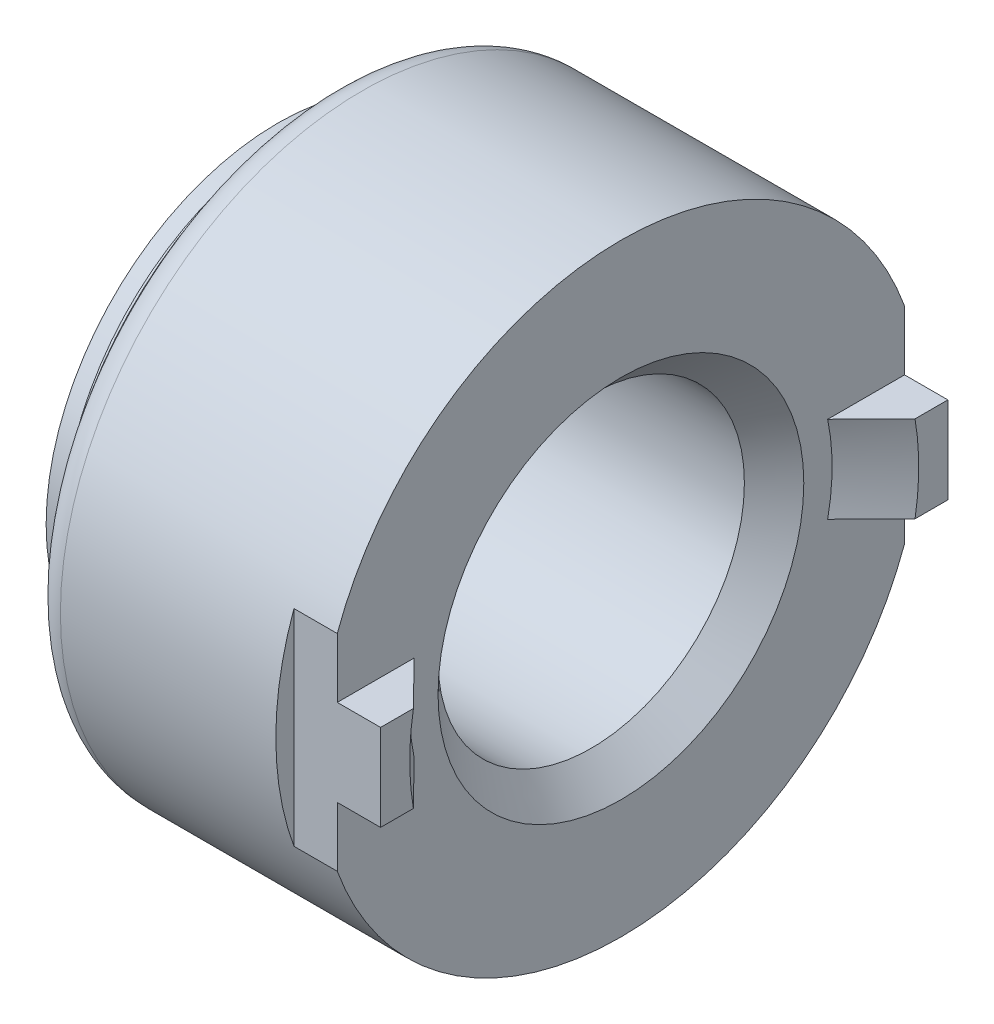
from build123d import *

# Parameters (mm, degrees)
ESQUISSE1_W             = 7.9
ESQUISSE1_H             = 8.25
BOSS_EXTRU_1_DEPTH      = 1.184
ENL_V_MAT_EXTRU_1_REACH = 15.462
BOSS_EXTRU_2_DEPTH      = 1.184
ENL_V_MAT_EXTRU_2_REACH = 15.462
ESQUISSE8_R             = 7.2925
BOSS_EXTRU_3_DEPTH      = 0.296
ESQUISSE9_R             = 6.10875
BOSS_EXTRU_4_DEPTH      = 0.74
BOSS_EXTRU_4_DRAFT      = -17.000658211
ESQUISSE10_R            = 6.335
BOSS_EXTRU_5_DEPTH      = 0.444
D_POUILLE1_ANGLE        = 44.999999999
PER_AGE1_D              = 8.376
CHANFREIN1_SIZE         = 0.812
CONG_1_R                = 0.825


with BuildPart() as part:
    # Esquisse1 → Révolution1 (revolve)
    with BuildSketch(Plane.XY, mode=Mode.PRIVATE) as r_volution1_sk:
        with Locations((5.43, 4.125)):
            Rectangle(ESQUISSE1_W, ESQUISSE1_H)
    revolve(r_volution1_sk.sketch.rotate(Axis((1.48, 0, 0), (1, 0, 0)), 270), axis=Axis((1.48, 0, 0), (1, 0, 0)))

    # Esquisse2 → Boss.-Extru.1 (add)
    with BuildSketch(Plane(origin=(9.38, 0, 0), x_dir=(0, 0, -1), z_dir=(1, 0, 0))):
        with BuildLine():
            Line((-5.652324212, -1.184), (-7.755, -1.184))
            Line((-7.755, -1.184), (-7.755, 1.184))
            Line((-7.755, 1.184), (-5.652324212, 1.184))
            ThreePointArc((-5.652324212, 1.184), (-5.775, 0), (-5.652324212, -1.184))
        make_face()
    extrude(amount=BOSS_EXTRU_1_DEPTH)

    # Esquisse4 → Enlèv. mat.-Extru.1 (cut, up to next)
    with BuildSketch(Plane(origin=(8.195, 0, 0), x_dir=(0, -1, 0), z_dir=(-1, 0, 0)), mode=Mode.PRIVATE) as enl_v_mat_extru_1_sk1:
        with BuildLine():
            Line((-2.814689148, 7.755), (2.814689148, 7.755))
            ThreePointArc((2.814689148, 7.755), (0, 8.25), (-2.814689148, 7.755))
        make_face()
    enl_v_mat_extru_1_tool1 = extrude(enl_v_mat_extru_1_sk1.sketch, amount=-ENL_V_MAT_EXTRU_1_REACH, mode=Mode.PRIVATE) & part.part
    add(enl_v_mat_extru_1_tool1.solids().sort_by_distance((8.195, 0, 7.953518))[0], mode=Mode.SUBTRACT)

    # Esquisse5 → Boss.-Extru.2 (add)
    with BuildSketch(Plane(origin=(9.38, 0, 0), x_dir=(0, 0, -1), z_dir=(1, 0, 0))):
        with BuildLine():
            Line((7.755, 1.184), (7.755, -1.184))
            Line((7.755, -1.184), (5.652324212, -1.184))
            ThreePointArc((5.652324212, -1.184), (5.775, 0), (5.652324212, 1.184))
            Line((5.652324212, 1.184), (7.755, 1.184))
        make_face()
    extrude(amount=BOSS_EXTRU_2_DEPTH)

    # Esquisse7 → Enlèv. mat.-Extru.2 (cut, up to next)
    with BuildSketch(Plane(origin=(8.195, 0, 0), x_dir=(0, -1, 0), z_dir=(-1, 0, 0)), mode=Mode.PRIVATE) as enl_v_mat_extru_2_sk1:
        with BuildLine():
            Line((2.814689148, -7.755), (-2.814689148, -7.755))
            ThreePointArc((-2.814689148, -7.755), (0, -8.25), (2.814689148, -7.755))
        make_face()
    enl_v_mat_extru_2_tool1 = extrude(enl_v_mat_extru_2_sk1.sketch, amount=-ENL_V_MAT_EXTRU_2_REACH, mode=Mode.PRIVATE) & part.part
    add(enl_v_mat_extru_2_tool1.solids().sort_by_distance((8.195, 0, -7.953518))[0], mode=Mode.SUBTRACT)

    # Esquisse8 → Boss.-Extru.3 (add)
    with BuildSketch(Plane.ZY.offset(-1.48)):
        with Locations(Location((0, 0, 0), (0, 0, 180))):
            Circle(ESQUISSE8_R)
    extrude(amount=BOSS_EXTRU_3_DEPTH)


with BuildPart() as boss_extru_4_tool:
    # Esquisse9 → Boss.-Extru.4 (with draft: the straight prism first)
    with BuildSketch(Plane.ZY.offset(-1.184)):
        Circle(ESQUISSE9_R)
    extrude(amount=BOSS_EXTRU_4_DEPTH)
    # Boss.-Extru.4: the draft: its side faces are tilted about the plane it starts from
    boss_extru_4_sides = [boss_extru_4_tool.faces().sort_by_distance(p)[0] for p in [
        (0.814, 0, -6.10875),
    ]]
    draft(boss_extru_4_sides, Plane.ZY.offset(-1.184), BOSS_EXTRU_4_DRAFT)


with BuildPart() as part_1:
    add(part.part)

    # Boss.-Extru.4: add boss_extru_4_tool
    add(boss_extru_4_tool.part)

    # Esquisse10 → Boss.-Extru.5 (add)
    with BuildSketch(Plane.ZY.offset(-0.444)):
        with Locations(Location((0, 0, 0), (0, 0, 180))):
            Circle(ESQUISSE10_R)
    extrude(amount=BOSS_EXTRU_5_DEPTH)

    # Dépouille1
    d_pouille1_faces = [part_1.faces().sort_by_distance(p)[0] for p in [
        (9.972, 0, 5.775),
        (9.972, 0, -5.775),
    ]]
    draft(d_pouille1_faces, Plane(origin=(9.38, 0, 0), x_dir=(0, 0, 1), z_dir=(1, 0, 0)), D_POUILLE1_ANGLE)

    # Perçage1 (through all)
    with Locations(Plane(origin=(9.38, 0, 0), x_dir=(0, 0, -1), z_dir=(1, 0, 0))):
        with Locations((0, 0)):
            Hole(PER_AGE1_D / 2)

    # Chanfrein1
    chanfrein1_edges = [part_1.edges().sort_by_distance(p)[0] for p in [
        (9.38, 0, -4.188),
        (0, 0, -4.188),
    ]]
    chamfer(chanfrein1_edges, length=CHANFREIN1_SIZE)

    # Congé1
    cong_1_edges = [part_1.edges().sort_by_distance(p)[0] for p in [
        (1.48, 0, 8.25),
    ]]
    fillet(cong_1_edges, radius=CONG_1_R)


solid = part_1.part
